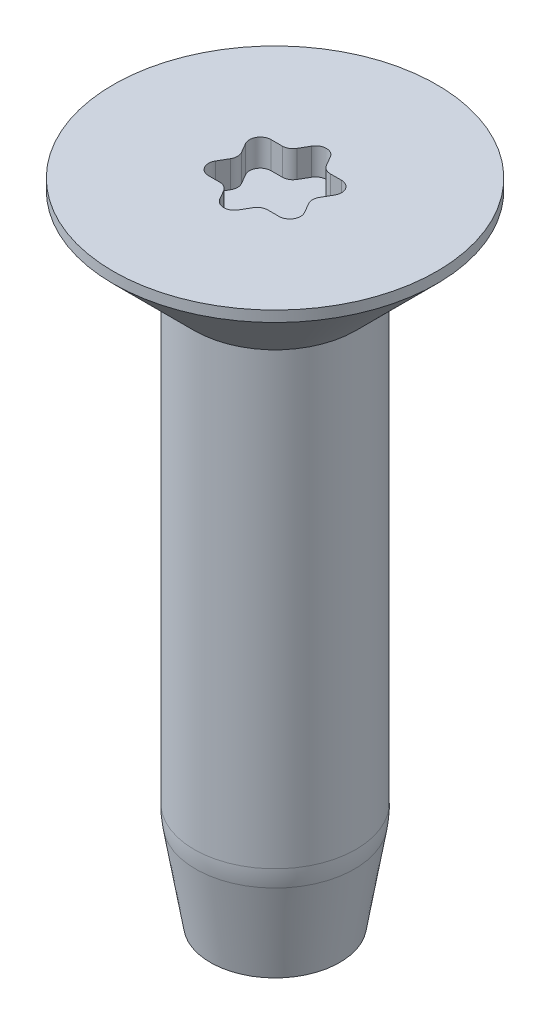
from build123d import *

# Parameters (mm, degrees)
SKETCH2_R           = 1.5
BOSS_EXTRUDE1_DEPTH = 10.3
CUT_EXTRUDE1_DEPTH  = 0.5
FILLET1_R           = 0.2
FILLET3_R           = 2


with BuildPart() as part:
    # Sketch1 → Revolve1 (revolve)
    with BuildSketch(Plane.XY, mode=Mode.PRIVATE) as revolve1_sk:
        Polygon((0, 0), (0, 1.7), (3, 1.7), (3, 1.5), (1.5, 0), align=None)
    revolve(revolve1_sk.sketch.rotate(Axis((0, 50, 0), (0, -1, 0)), 90), axis=Axis((0, 50, 0), (0, -1, 0)))

    # Sketch2 → Boss-Extrude1 (add)
    with BuildSketch(Plane.XZ):
        with Locations(Location((0, 0, 0), (0, 0, 270))):
            Circle(SKETCH2_R)
    extrude(amount=BOSS_EXTRUDE1_DEPTH)

    # Sketch3 → Cut-Revolve1 (revolve, cut)
    with BuildSketch(Plane.XY, mode=Mode.PRIVATE) as cut_revolve1_sk:
        Polygon((1.5, -8.5), (1.2, -10.3), (1.5, -10.3), align=None)
    revolve(cut_revolve1_sk.sketch.rotate(Axis((0, 0, 0), (0, -1, 0)), 180), axis=Axis((0, 0, 0), (0, -1, 0)), mode=Mode.SUBTRACT)

    # Sketch4 → Cut-Extrude1 (cut)
    with BuildSketch(Plane(origin=(0, 1.7, 0), x_dir=(1, 0, 0), z_dir=(0, 1, 0))):
        Polygon((0, 1.152050808), (0.330273688, 0.58), (1, 0.58), (0.665136844, 0), (1, -0.58), (0.330273688, -0.58), (0, -1.152050808), (-0.330273688, -0.58), (-1, -0.58), (-0.665136844, 0), (-1, 0.58), (-0.330273688, 0.58), align=None)
    extrude(amount=-CUT_EXTRUDE1_DEPTH, mode=Mode.SUBTRACT)

    # Fillet1
    fillet1_edges = [part.edges().sort_by_distance(p)[0] for p in [
        (-0.330273688, 1.45, -0.58),
        (0, 1.45, -1.152050808),
        (0.330273688, 1.45, -0.58),
        (1, 1.45, -0.58),
        (0.665136844, 1.45, 0),
        (1, 1.45, 0.58),
        (0.330273688, 1.45, 0.58),
        (0, 1.45, 1.152050808),
        (-0.330273688, 1.45, 0.58),
        (-1, 1.45, 0.58),
        (-0.665136844, 1.45, 0),
        (-1, 1.45, -0.58),
    ]]
    fillet(fillet1_edges, radius=FILLET1_R)

    # Fillet3
    fillet3_edges = [part.edges().sort_by_distance(p)[0] for p in [
        (-1.060660172, -8.5, -1.060660172),
    ]]
    fillet(fillet3_edges, radius=FILLET3_R)


solid = part.part
